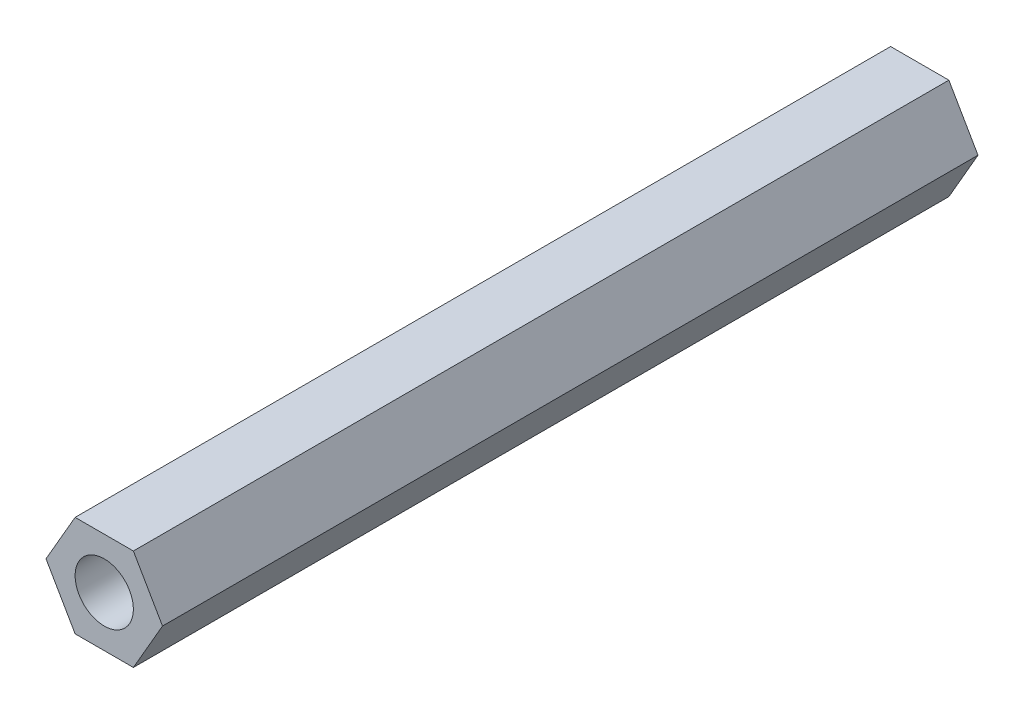
from build123d import *

# Parameters (mm, degrees)
EXTRUDE_1_DEPTH    = 35
HOLE_WIZARD_M3_1_D = 2.5


with BuildPart() as part:
    # 草图1 → 凸台-拉伸1 (new body)
    with BuildSketch(Plane.XY):
        Polygon((0, 0), (2.5, 0), (3.75, -2.165063509), (2.5, -4.330127019), (0, -4.330127019), (-1.25, -2.165063509), align=None)
    extrude(amount=EXTRUDE_1_DEPTH)

    # M3 螺纹孔1 (through all)
    with Locations(Plane.XY.offset(35)):
        with Locations((1.25, -2.165063509)):
            Hole(HOLE_WIZARD_M3_1_D / 2)


solid = part.part
